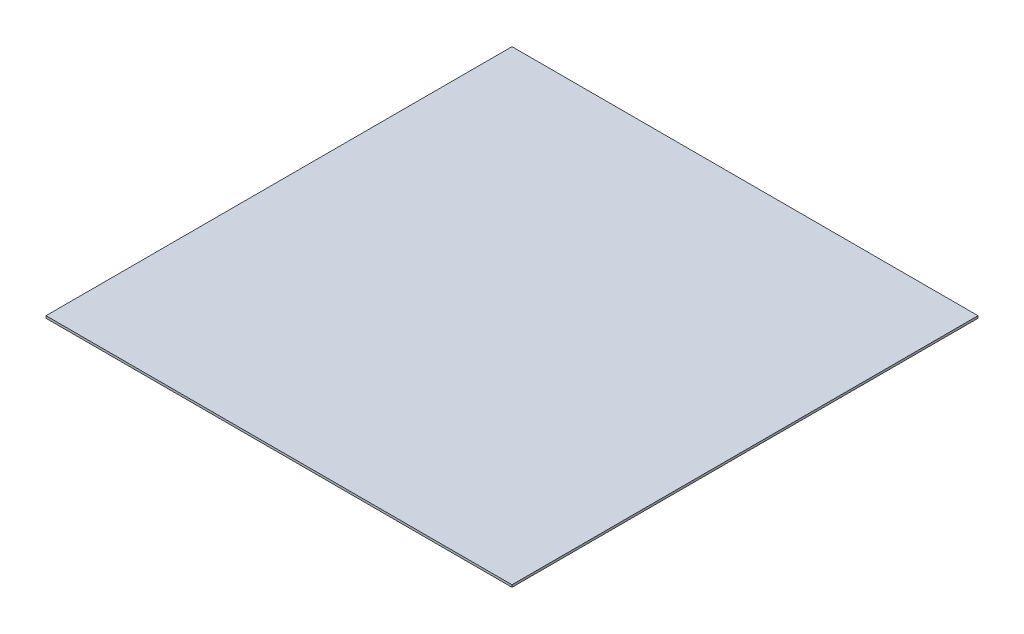
from build123d import *

# Parameters (mm, degrees)
SKETCH_1_W      = 82
SKETCH_1_H      = 82
EXTRUDE_1_DEPTH = 0.4


with BuildPart() as part:
    # 草图1 → 凸台-拉伸1 (new body)
    with BuildSketch(Plane(origin=(0, 0, 0), x_dir=(1, 0, 0), z_dir=(0, 1, 0))):
        Rectangle(SKETCH_1_W, SKETCH_1_H)
    extrude(amount=EXTRUDE_1_DEPTH)


solid = part.part
